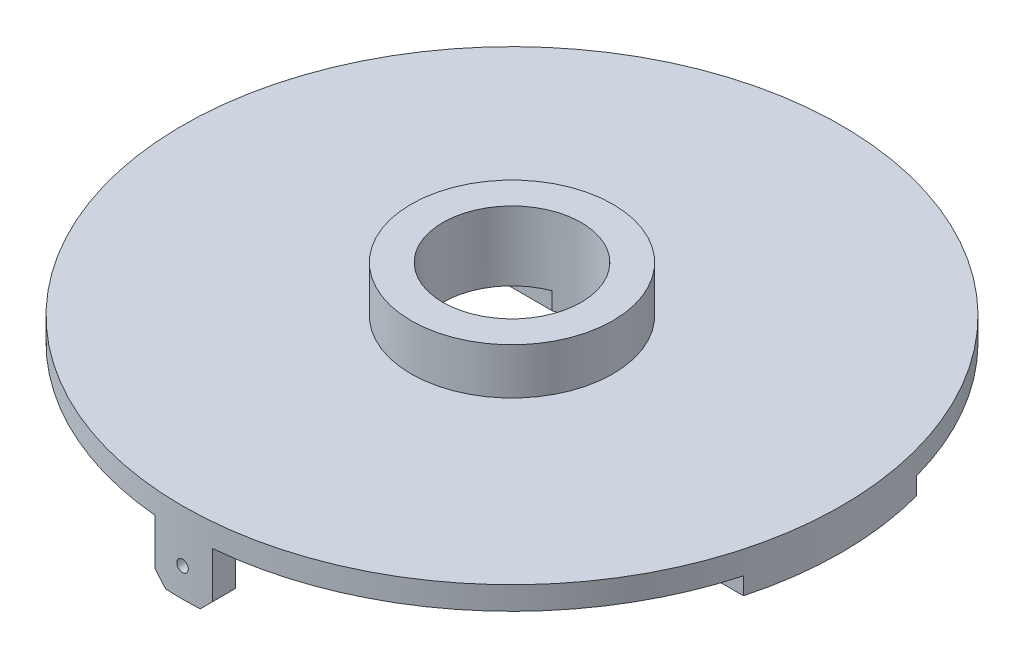
from build123d import *
from build123d.topology import SkipClean

# Parameters (mm, degrees)
SKETCH2_R               = 17.5
BOSS_EXTRUDE3_DEPTH     = 8
CUT_EXTRUDE3_DEPTH      = 8
CUT_EXTRUDE3_DEPTH_BACK = 10
SKETCH10_R              = 12
SKETCH11_W              = 54.5
SKETCH11_H              = 30
BOSS_EXTRUDE7_DEPTH     = 7
SKETCH12_W              = 39.5
SKETCH12_H              = 22
CUT_EXTRUDE4_DEPTH      = 43.148546831
SKETCH18_R              = 65
CUT_EXTRUDE6_DEPTH      = 4
SKETCH24_R              = 1
CUT_EXTRUDE7_DEPTH      = 4
SKETCH33_R              = 57.15
BOSS_EXTRUDE8_DEPTH     = 4
SKETCH34_R              = 12
CUT_EXTRUDE8_DEPTH      = 7
BOSS_EXTRUDE13_DEPTH    = 10
F_1_0MM_DOWEL_HOLE1_D   = 2
BOSS_EXTRUDE14_DEPTH    = 3
BOSS_EXTRUDE15_REACH    = 96.659
SKETCH21_W              = 30
SKETCH21_H              = 3
BOSS_EXTRUDE16_REACH    = 113.448
SKETCH31_W              = 30
SKETCH31_H              = 3
CHAMFER1_SIZE           = 2


with BuildPart() as part:
    # Sketch2 → Boss-Extrude3 (new body)
    with BuildSketch(Plane(origin=(0, 0, 0), x_dir=(1, 0, 0), z_dir=(0, 1, 0))):
        with Locations(Location((0, 0, 0), (0, 0, 270))):
            Circle(SKETCH2_R)
    extrude(amount=BOSS_EXTRUDE3_DEPTH)

    # Sketch10 → Cut-Extrude3 (cut, two sides: drawn at the far end of the back side and taken through both)
    with BuildSketch(Plane(origin=(0, 0, 0), x_dir=(1, 0, 0), z_dir=(0, 1, 0)).offset(-CUT_EXTRUDE3_DEPTH_BACK)):
        with Locations(Location((0, 0, 0), (0, 0, 270))):
            Circle(SKETCH10_R)
    extrude(amount=CUT_EXTRUDE3_DEPTH + CUT_EXTRUDE3_DEPTH_BACK, mode=Mode.SUBTRACT)

    # Sketch11 → Boss-Extrude7 (add)
    with BuildSketch(Plane(origin=(0, 0, 0), x_dir=(1, 0, 0), z_dir=(0, 1, 0))):
        with Locations((-10.25, 0)):
            Rectangle(SKETCH11_W, SKETCH11_H)
    extrude(amount=-BOSS_EXTRUDE7_DEPTH)

    # Sketch12 → Cut-Extrude4 (cut, through all)
    with BuildSketch(Plane(origin=(0, 0, 0), x_dir=(1, 0, 0), z_dir=(0, 1, 0))):
        with Locations((-10.311158619, 0.223490858)):
            Rectangle(SKETCH12_W, SKETCH12_H)
    extrude(amount=-CUT_EXTRUDE4_DEPTH, mode=Mode.SUBTRACT)

    # Sketch18 → Cut-Extrude6 (cut)
    with BuildSketch(Plane(origin=(0, 0, 0), x_dir=(1, 0, 0), z_dir=(0, 1, 0))):
        Circle(SKETCH18_R)
    extrude(amount=-CUT_EXTRUDE6_DEPTH, mode=Mode.SUBTRACT)


with BuildPart() as cut_extrude6_piece_1:
    # of the separate pieces the step leaves, piece 1, a body of its own (cut_extrude6_pieces)
    add(part.part.solids().sort_by_distance((0, 0, 17.5))[0])



with BuildPart() as cut_extrude6_piece_2:
    # of the separate pieces the step leaves, piece 2, a body of its own (cut_extrude6_pieces)
    add(part.part.solids().sort_by_distance((-37.5, -4, 15))[0])

    # Sketch24 → Cut-Extrude7 (cut)
    with BuildSketch(Plane.XZ.offset(7)):
        with Locations(Location((-33.811158619, 4.276509142, 0), (0, 0, 270))):
            Circle(SKETCH24_R)
        with Locations(Location((-33.811158619, -5.723490858, 0), (0, 0, 270))):
            Circle(SKETCH24_R)
        with Locations(Location((13.311158619, -5.723490858, 0), (0, 0, 90))):
            Circle(SKETCH24_R)
        with Locations(Location((13.311158619, 4.276509142, 0), (0, 0, 90))):
            Circle(SKETCH24_R)
    extrude(amount=-CUT_EXTRUDE7_DEPTH, mode=Mode.SUBTRACT)


with BuildPart() as cut_extrude6_piece_1_1:
    add(cut_extrude6_piece_1.part)

    add(cut_extrude6_piece_2.part)  # Boss-Extrude8 merges Cut-Extrude6 piece 2
    # Sketch33 → Boss-Extrude8 (add)
    with BuildSketch(Plane(origin=(0, 0, 0), x_dir=(1, 0, 0), z_dir=(0, 1, 0))):
        with Locations(Location((0, 0, 0), (0, 0, 270))):
            Circle(SKETCH33_R)
    extrude(amount=-BOSS_EXTRUDE8_DEPTH)

    # Sketch34 → Cut-Extrude8 (cut)
    with BuildSketch(Plane(origin=(0, 0, 0), x_dir=(1, 0, 0), z_dir=(0, 1, 0))):
        with Locations(Location((0, 0, 0), (0, 0, 270))):
            Circle(SKETCH34_R)
    extrude(amount=-CUT_EXTRUDE8_DEPTH, mode=Mode.SUBTRACT)

    # Sketch37 → Boss-Extrude13 (add)
    with SkipClean():  # the faces are left unmerged after this step: merging them gives an invalid solid
        with BuildSketch(Plane.XZ.offset(4)):
            with BuildLine():
                Line((-5, -52.91429391), (-5, -56.930857187))
                ThreePointArc((-5, -56.930857187), (0, -57.15), (5, -56.930857187))
                Line((5, -56.930857187), (5, -52.91429391))
                ThreePointArc((5, -52.91429391), (0, -53.15), (-5, -52.91429391))
            make_face()
            with BuildLine():
                Line((-5, 56.930857187), (-5, 52.91429391))
                ThreePointArc((-5, 52.91429391), (0, 53.15), (5, 52.91429391))
                Line((5, 52.91429391), (5, 56.930857187))
                ThreePointArc((5, 56.930857187), (0, 57.15), (-5, 56.930857187))
            make_face()
        extrude(amount=BOSS_EXTRUDE13_DEPTH)

    # Ø1.0mm Dowel Hole1 (through all)
    with Locations(Plane(origin=(0, -9, -57.15), x_dir=(-1, 0, 0), z_dir=(0, 0, -1))):
        with Locations((0, 0)):
            Hole(F_1_0MM_DOWEL_HOLE1_D / 2)

    # Sketch86 → Boss-Extrude14 (add)
    with SkipClean():  # the faces are left unmerged after this step: merging them gives an invalid solid
        with BuildSketch(Plane(origin=(0, -4, 0), x_dir=(-1, 0, 0), z_dir=(0, -1, 0))):
            with BuildLine():
                Line((-51.119442268, -15), (-55.146373408, -15))
                ThreePointArc((-55.146373408, -15), (-57.15, 0), (-55.146373408, 15))
                Line((-55.146373408, 15), (-51.119442268, 15))
                ThreePointArc((-51.119442268, 15), (-53.274734892, 0), (-51.119442268, -15))
            make_face()
            with BuildLine():
                Line((51.119442268, -15), (55.146373408, -15))
                ThreePointArc((55.146373408, -15), (57.15, 0), (55.146373408, 15))
                Line((55.146373408, 15), (51.119442268, 15))
                ThreePointArc((51.119442268, 15), (53.274734892, 0), (51.119442268, -15))
            make_face()
        extrude(amount=BOSS_EXTRUDE14_DEPTH)

    # Sketch21 → Boss-Extrude15 (add, up to next)
    with BuildSketch(Plane(origin=(17, 0, 0), x_dir=(0, 0, -1), z_dir=(1, 0, 0)), mode=Mode.PRIVATE) as boss_extrude15_sk1:
        with Locations((0, -5.5)):
            Rectangle(SKETCH21_W, SKETCH21_H)
    boss_extrude15_tool1 = extrude(boss_extrude15_sk1.sketch, amount=BOSS_EXTRUDE15_REACH, mode=Mode.PRIVATE) - cut_extrude6_piece_1_1.part
    add(boss_extrude15_tool1.solids().sort_by_distance((17, -5.5, 0))[0])

    # Sketch31 → Boss-Extrude16 (add, up to next)
    with BuildSketch(Plane.ZY.offset(37.5), mode=Mode.PRIVATE) as boss_extrude16_sk1:
        with Locations((0, -5.5)):
            Rectangle(SKETCH31_W, SKETCH31_H)
    boss_extrude16_tool1 = extrude(boss_extrude16_sk1.sketch, amount=BOSS_EXTRUDE16_REACH, mode=Mode.PRIVATE) - cut_extrude6_piece_1_1.part
    add(boss_extrude16_tool1.solids().sort_by_distance((-37.5, -5.5, 0))[0])

    # Chamfer1
    chamfer1_edges = [cut_extrude6_piece_1_1.edges().sort_by_distance(p)[0] for p in [
        (5, -14, -54.922575548),
        (-5, -14, -54.922575548),
        (-5, -14, 54.922575548),
        (5, -14, 54.922575548),
    ]]
    chamfer(chamfer1_edges, length=CHAMFER1_SIZE)


solid = cut_extrude6_piece_1_1.part
